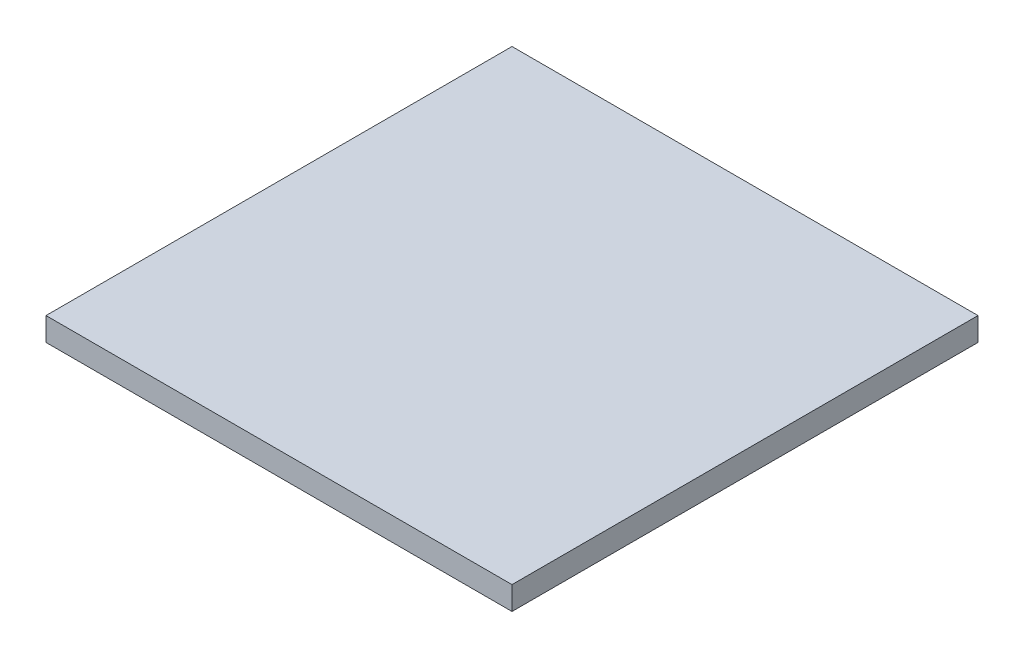
from build123d import *

# Parameters (mm, degrees)
SKETCH1_W           = 40
SKETCH1_H           = 40
BOSS_EXTRUDE1_DEPTH = 2


with BuildPart() as part:
    # Sketch1 → Boss-Extrude1 (new body)
    with BuildSketch(Plane(origin=(0, 0, 0), x_dir=(1, 0, 0), z_dir=(0, 1, 0))):
        with Locations((20, 20)):
            Rectangle(SKETCH1_W, SKETCH1_H)
    extrude(amount=BOSS_EXTRUDE1_DEPTH)


solid = part.part
